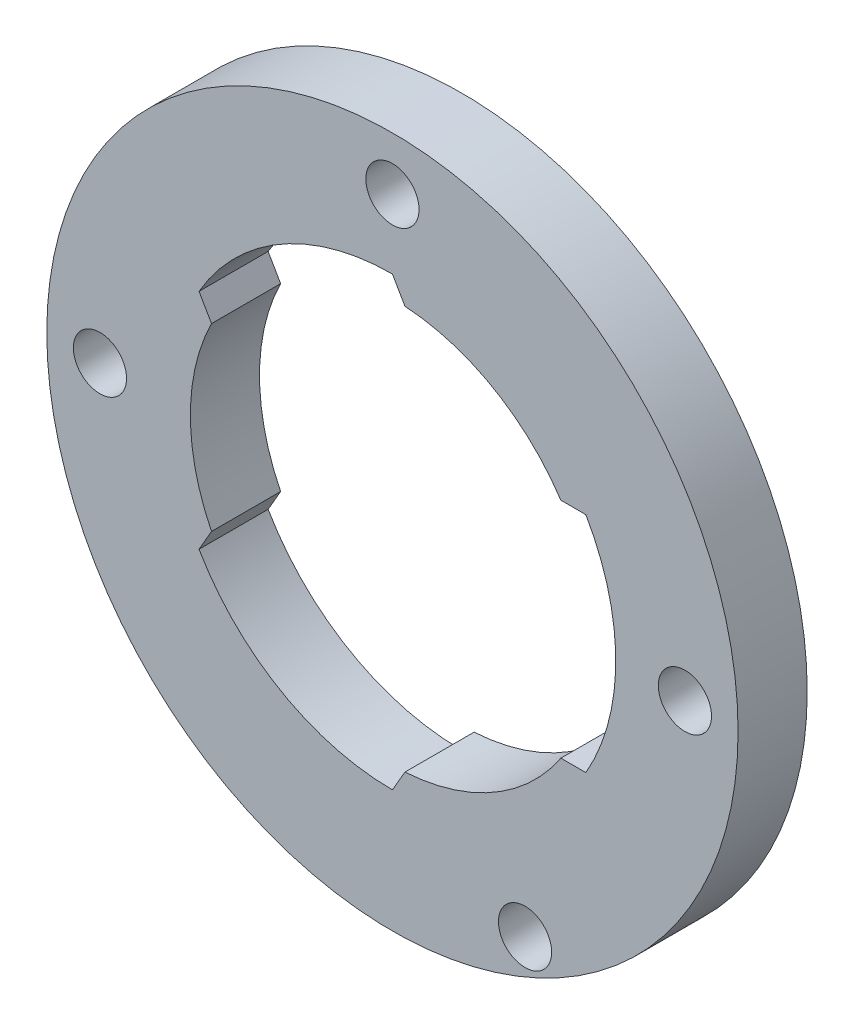
from build123d import *

# Parameters (mm, degrees)
SKETCH1_R                  = 41.275
SKETCH1_R_2                = 24.13
BOSS_EXTRUDE1_DEPTH        = 4.1275
F_3_4_3_4_DIAMETER_HOLE1_D = 3.4
CUT_EXTRUDE2_DEPTH         = 59.952491678
CIRPATTERN1_COUNT          = 3
F_3_4_3_4_DIAMETER_HOLE2_D = 3.4
SKETCH8_R                  = 3.175
CUT_EXTRUDE3_DEPTH         = 5.999999906


with BuildPart() as part:
    # Sketch1 → Boss-Extrude1 (new, symmetric)
    with BuildSketch(Plane.XY):
        Circle(SKETCH1_R)
        Circle(SKETCH1_R_2, mode=Mode.SUBTRACT)
    extrude(amount=BOSS_EXTRUDE1_DEPTH, both=True)

    # Ø3.4 (3.4) Diameter Hole1 (through all)
    with Locations(Plane.XY.offset(4.1275)):
        with Locations((-34.925, 0), (0, 34.925), (34.925, 0)):
            Hole(F_3_4_3_4_DIAMETER_HOLE1_D / 2)

    # Sketch5 → Cut-Extrude2 (cut, through all)
    with BuildSketch(Plane(origin=(0, 0, -4.1275), x_dir=(-1, 0, 0), z_dir=(0, 0, -1))):
        with BuildLine():
            Line((-23.096897519, 13.335), (0, 13.335))
            Line((0, 13.335), (0, -13.335))
            Line((0, -13.335), (-23.096897519, -13.335))
            ThreePointArc((-23.096897519, -13.335), (-26.67, 0), (-23.096897519, 13.335))
        make_face()
    cut_extrude2 = extrude(amount=-CUT_EXTRUDE2_DEPTH, mode=Mode.SUBTRACT)

    # CirPattern1: Cut-Extrude2 ×3 about axis
    cirpattern1_axis = Axis((0, 0, 0), (0, 0, 1))
    for i in range(1, CIRPATTERN1_COUNT):
        add(cut_extrude2.rotate(cirpattern1_axis, i * 360 / CIRPATTERN1_COUNT), mode=Mode.SUBTRACT)

    # Ø3.4 (3.4) Diameter Hole2 (through all)
    with Locations(Plane.XY.offset(4.1275)):
        with Locations((15.833393176, -33.954821241)):
            Hole(F_3_4_3_4_DIAMETER_HOLE2_D / 2)

    # Sketch8 → Cut-Extrude3 (cut)
    with BuildSketch(Plane.XY.offset(4.1275)):
        with Locations((0, 34.925)):
            Circle(SKETCH8_R)
        with Locations((34.925, 0)):
            Circle(SKETCH8_R)
        with Locations((15.833393176, -33.954821241)):
            Circle(SKETCH8_R)
        with Locations((-34.925, 0)):
            Circle(SKETCH8_R)
    extrude(amount=-CUT_EXTRUDE3_DEPTH, mode=Mode.SUBTRACT)


solid = part.part
